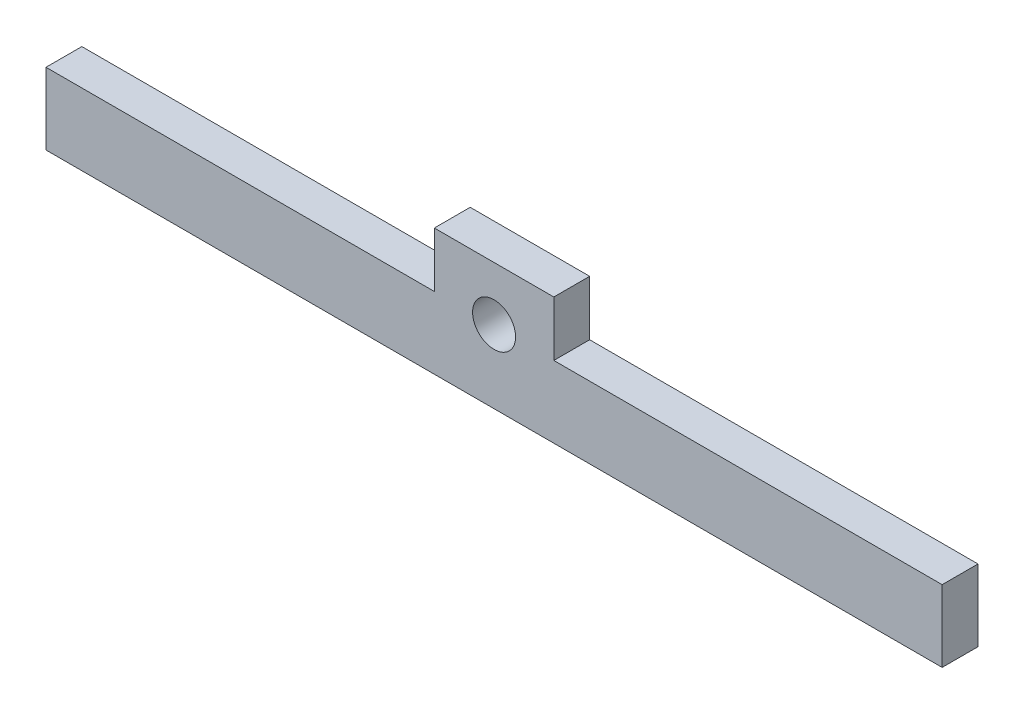
from build123d import *

# Parameters (mm, degrees)
CROQUIS1_R              = 9
SALIENTE_EXTRUIR1_DEPTH = 15


with BuildPart() as part:
    # Croquis1 → Saliente-Extruir1 (new body)
    with BuildSketch(Plane.XY):
        Polygon((-187.5, 0), (187.5, 0), (187.5, 30), (25, 30), (25, 53), (-25, 53), (-25, 30), (-187.5, 30), align=None)
        with Locations((0, 30.5)):
            Circle(CROQUIS1_R, mode=Mode.SUBTRACT)
    extrude(amount=SALIENTE_EXTRUIR1_DEPTH)


solid = part.part
